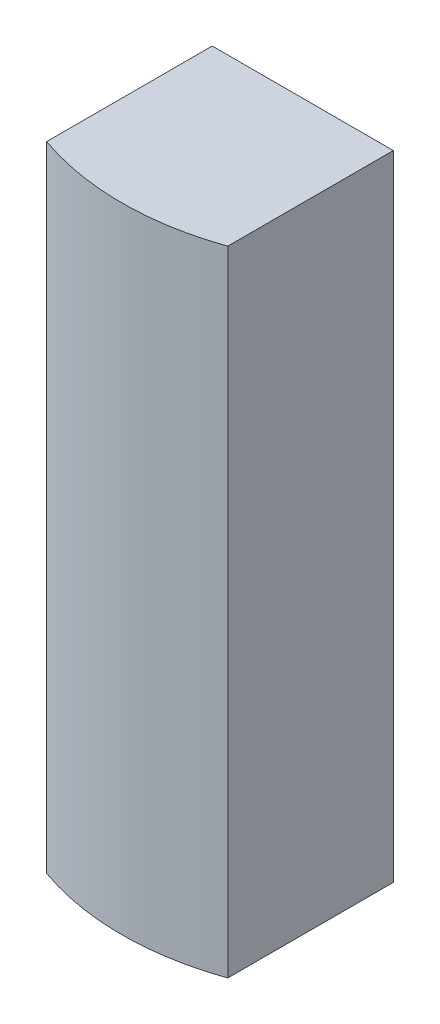
from build123d import *

# Parameters (mm, degrees)
EXTRUDE_1_DEPTH = 140


with BuildPart() as part:
    # 草图1 → 凸台-拉伸1 (new body)
    with BuildSketch(Plane(origin=(0, 0, 0), x_dir=(1, 0, 0), z_dir=(0, 1, 0))):
        with BuildLine():
            Line((20, -20), (-20, -20))
            Line((-20, -20), (-20, -56.568542495))
            ThreePointArc((-20, -56.568542495), (0, -60), (20, -56.568542495))
            Line((20, -56.568542495), (20, -20))
        make_face()
    extrude(amount=EXTRUDE_1_DEPTH)


solid = part.part
